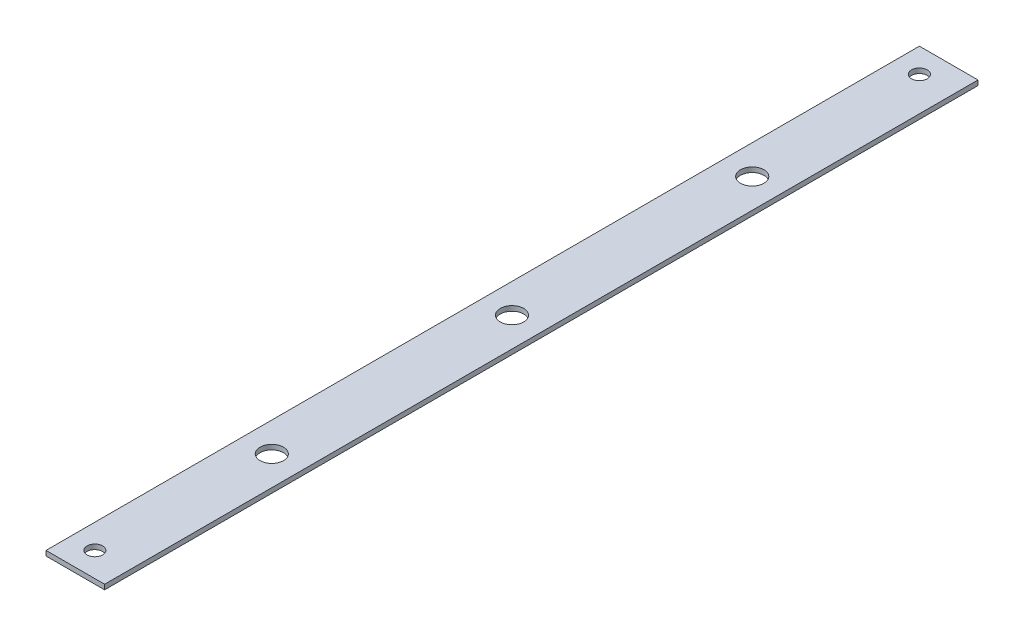
from build123d import *

# Parameters (mm, degrees)
SKETCH1_W           = 30
SKETCH1_H           = 2.5
BOSS_EXTRUDE1_DEPTH = 223.6
SKETCH2_R           = 4
SKETCH2_R_2         = 6
CUT_EXTRUDE1_DEPTH  = 226.617397379


with BuildPart() as part:
    # Sketch1 → Boss-Extrude1 (new, symmetric)
    with BuildSketch(Plane.XY):
        with Locations((15, 1.25)):
            Rectangle(SKETCH1_W, SKETCH1_H)
    extrude(amount=BOSS_EXTRUDE1_DEPTH, both=True)

    # Sketch2 → Cut-Extrude1 (cut, through all)
    with BuildSketch(Plane(origin=(0, 2.5, 0), x_dir=(1, 0, 0), z_dir=(0, 1, 0))):
        with Locations(Location((12.5, 211.1, 0), (0, 0, 180))):
            Circle(SKETCH2_R)
        with Locations((12.5, -211.1)):
            Circle(SKETCH2_R)
        with Locations(Location((15, -123, 0), (0, 0, 180))):
            Circle(SKETCH2_R_2)
        with Locations((15, 123)):
            Circle(SKETCH2_R_2)
        with Locations(Location((15, 0, 0), (0, 0, 180))):
            Circle(SKETCH2_R_2)
    extrude(amount=-CUT_EXTRUDE1_DEPTH, mode=Mode.SUBTRACT)


solid = part.part
